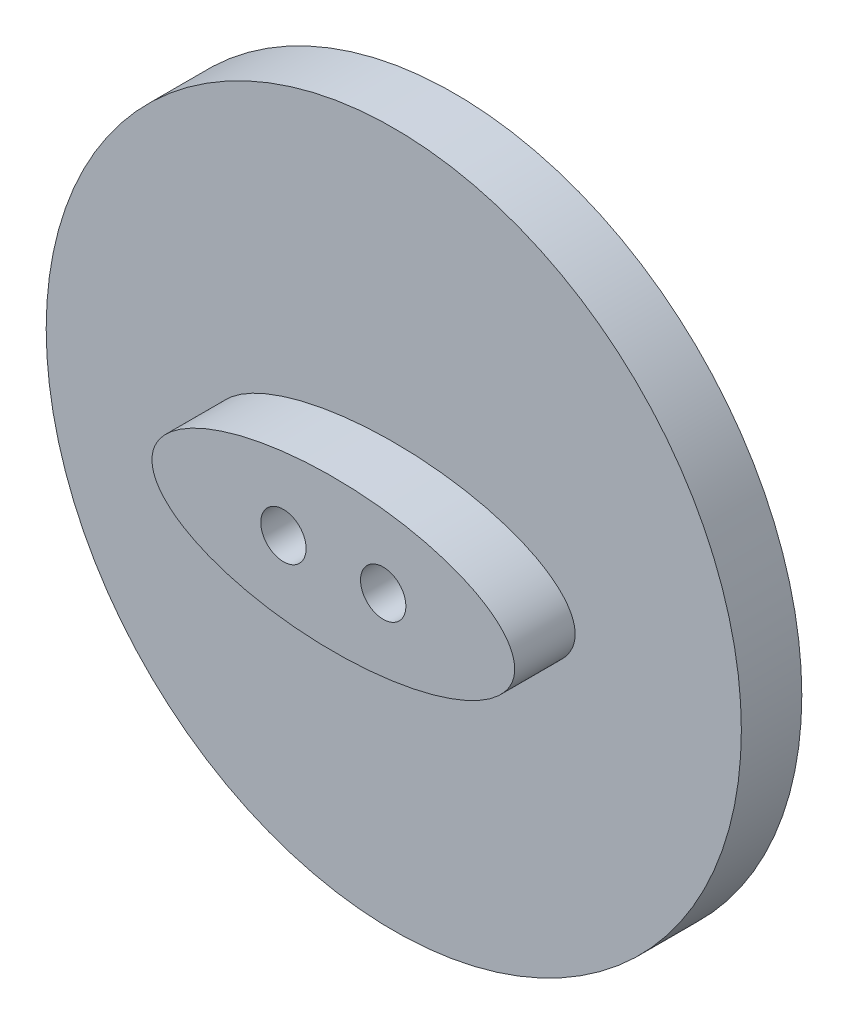
from build123d import *

# Parameters (mm, degrees)
ESQUISSE1_R             = 11.5
BOSS_EXTRU_1_DEPTH      = 2
ESQUISSE6_RX            = 6
ESQUISSE6_RY            = 2.5
BOSS_EXTRU_5_DEPTH      = 2
ESQUISSE7_R             = 0.75
ENL_V_MAT_EXTRU_1_DEPTH = 17.748134224


with BuildPart() as part:
    # Esquisse1 → Boss.-Extru.1 (new body)
    with BuildSketch(Plane.XY):
        Circle(ESQUISSE1_R)
    extrude(amount=BOSS_EXTRU_1_DEPTH)

    # Esquisse6 → Boss.-Extru.5 (add)
    with BuildSketch(Plane.XY.offset(2)):
        with Locations((0, 0)):
            Ellipse(ESQUISSE6_RX, ESQUISSE6_RY)
    extrude(amount=BOSS_EXTRU_5_DEPTH)

    # Esquisse7 → Enlèv. mat.-Extru.1 (cut, through all)
    with BuildSketch(Plane(origin=(0, 0, 0), x_dir=(-1, 0, 0), z_dir=(0, 0, -1))):
        with Locations((1.650464666, 0)):
            Circle(ESQUISSE7_R)
        with Locations((-1.650464666, 0)):
            Circle(ESQUISSE7_R)
    extrude(amount=-ENL_V_MAT_EXTRU_1_DEPTH, mode=Mode.SUBTRACT)


solid = part.part
